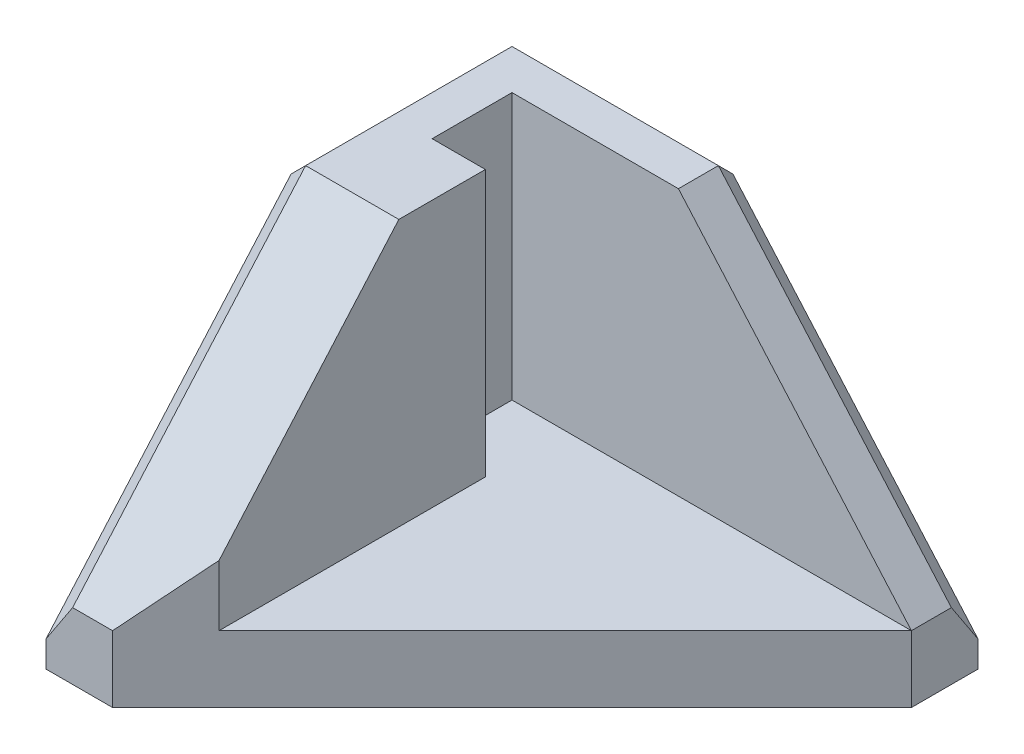
from build123d import *

# Parameters (mm, degrees)
BOSS_EXTRUDE1_DEPTH = 5
BOSS_EXTRUDE2_DEPTH = 20
CUT_EXTRUDE1_DEPTH  = 20
CUT_EXTRUDE2_DEPTH  = 20
CHAMFER1_SIZE       = 2


with BuildPart() as part:
    # Sketch1 → Boss-Extrude1 (new body)
    with BuildSketch(Plane(origin=(0, 0, 0), x_dir=(1, 0, 0), z_dir=(0, 1, 0))):
        Polygon((17.5, 12.5), (-12.5, -17.5), (-17.5, -17.5), (-17.5, 17.5), (17.5, 17.5), align=None)
    extrude(amount=BOSS_EXTRUDE1_DEPTH)

    # Sketch2 → Boss-Extrude2 (add)
    with BuildSketch(Plane(origin=(0, 5, 0), x_dir=(1, 0, 0), z_dir=(0, 1, 0))):
        Polygon((17.5, 17.5), (-17.5, 17.5), (-17.5, 12.5), (-17.5, -17.5), (-12.5, -17.5), (-8.5, -13.5), (-8.5, 6.5), (-12.5, 6.5), (-12.5, 12.5), (17.5, 12.5), align=None)
    extrude(amount=BOSS_EXTRUDE2_DEPTH)

    # Sketch3 → Cut-Extrude1 (cut)
    with BuildSketch(Plane(origin=(0, 0, -17.5), x_dir=(-1, 0, 0), z_dir=(0, 0, -1))):
        Polygon((-17.5, 5), (0, 25), (-17.5, 25), align=None)
    extrude(amount=-CUT_EXTRUDE1_DEPTH, mode=Mode.SUBTRACT)

    # Sketch4 → Cut-Extrude2 (cut)
    with BuildSketch(Plane.ZY.offset(17.5)):
        Polygon((17.5, 5), (0, 25), (17.5, 25), align=None)
    extrude(amount=-CUT_EXTRUDE2_DEPTH, mode=Mode.SUBTRACT)

    # Chamfer1
    chamfer1_edges = [part.edges().sort_by_distance(p)[0] for p in [
        (-17.5, 25, -8.75),
        (-8.75, 25, -17.5),
        (8.75, 15, -17.5),
        (-17.5, 15, 8.75),
    ]]
    chamfer(chamfer1_edges, length=CHAMFER1_SIZE)


solid = part.part
